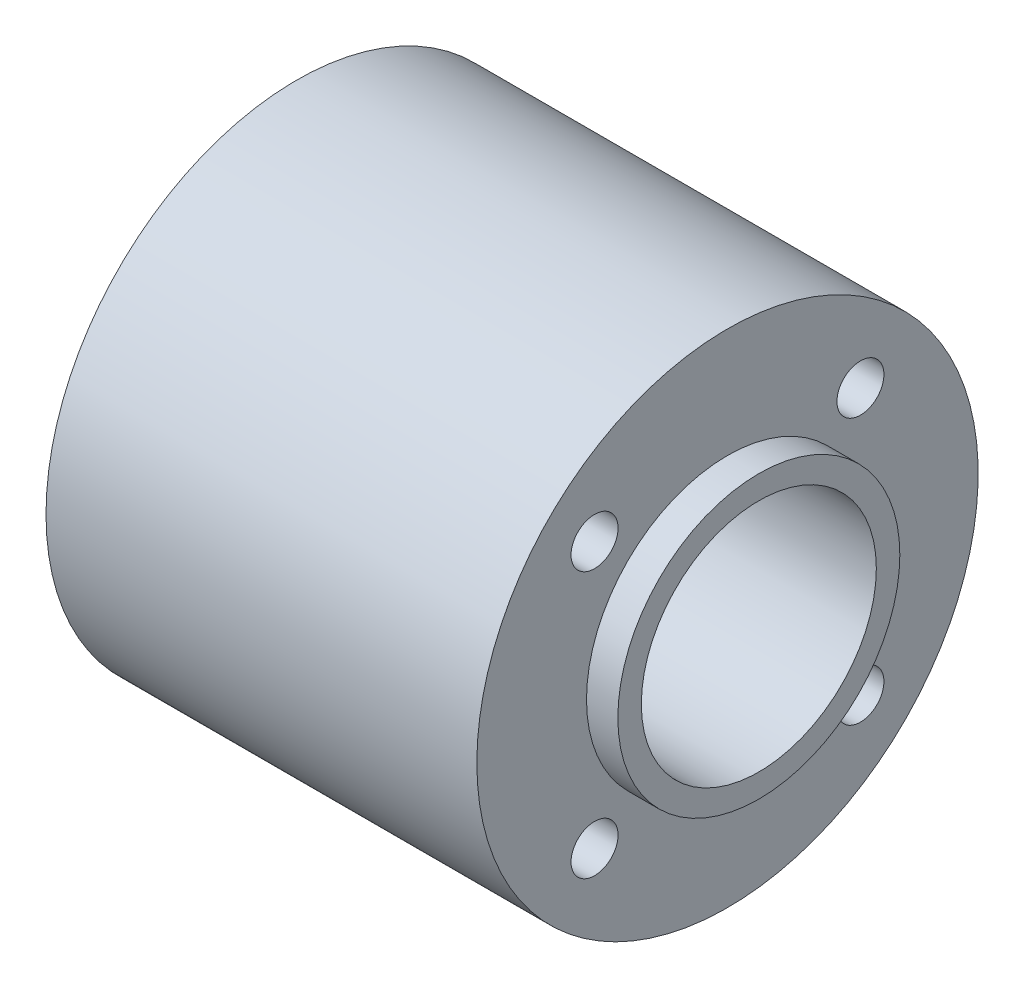
from build123d import *

# Parameters (mm, degrees)
SKETCH2_R          = 1.5
CUT_EXTRUDE1_DEPTH = 38.17862289


with BuildPart() as part:
    # Sketch1 → Revolve1 (revolve)
    with BuildSketch(Plane.XY, mode=Mode.PRIVATE) as revolve1_sk:
        Polygon((0, 9), (2, 9), (2, 16), (29.5, 16), (29.5, 9), (31.5, 9), (31.5, 7.5), (0, 7.5), align=None)
    revolve(revolve1_sk.sketch.rotate(Axis((0, 0, 0), (1, 0, 0)), 90), axis=Axis((0, 0, 0), (1, 0, 0)))

    # Sketch2 → Cut-Extrude1 (cut, through all)
    with BuildSketch(Plane.ZY.offset(-2)):
        with Locations((-8.485281374, 8.485281374)):
            Circle(SKETCH2_R)
        with Locations((8.485281374, 8.485281374)):
            Circle(SKETCH2_R)
        with Locations((8.485281374, -8.485281374)):
            Circle(SKETCH2_R)
        with Locations((-8.485281374, -8.485281374)):
            Circle(SKETCH2_R)
    extrude(amount=-CUT_EXTRUDE1_DEPTH, mode=Mode.SUBTRACT)


solid = part.part
